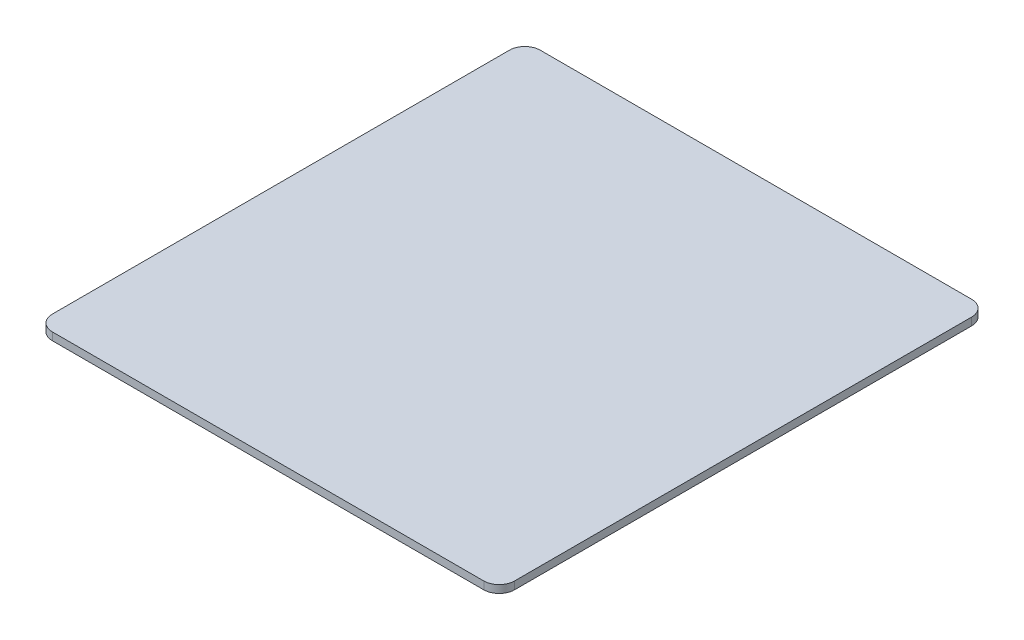
from build123d import *

# Parameters (mm, degrees)
SKETCH1_W           = 180
SKETCH1_H           = 190
BOSS_EXTRUDE1_DEPTH = 3
FILLET1_R           = 6


with BuildPart() as part:
    # Sketch1 → Boss-Extrude1 (new body)
    with BuildSketch(Plane(origin=(0, 0, 0), x_dir=(1, 0, 0), z_dir=(0, 1, 0))):
        Rectangle(SKETCH1_W, SKETCH1_H)
    extrude(amount=-BOSS_EXTRUDE1_DEPTH)

    # Fillet1
    fillet1_edges = [part.edges().sort_by_distance(p)[0] for p in [
        (90, -1.5, 95),
        (-90, -1.5, 95),
        (-90, -1.5, -95),
        (90, -1.5, -95),
    ]]
    fillet(fillet1_edges, radius=FILLET1_R)


solid = part.part
